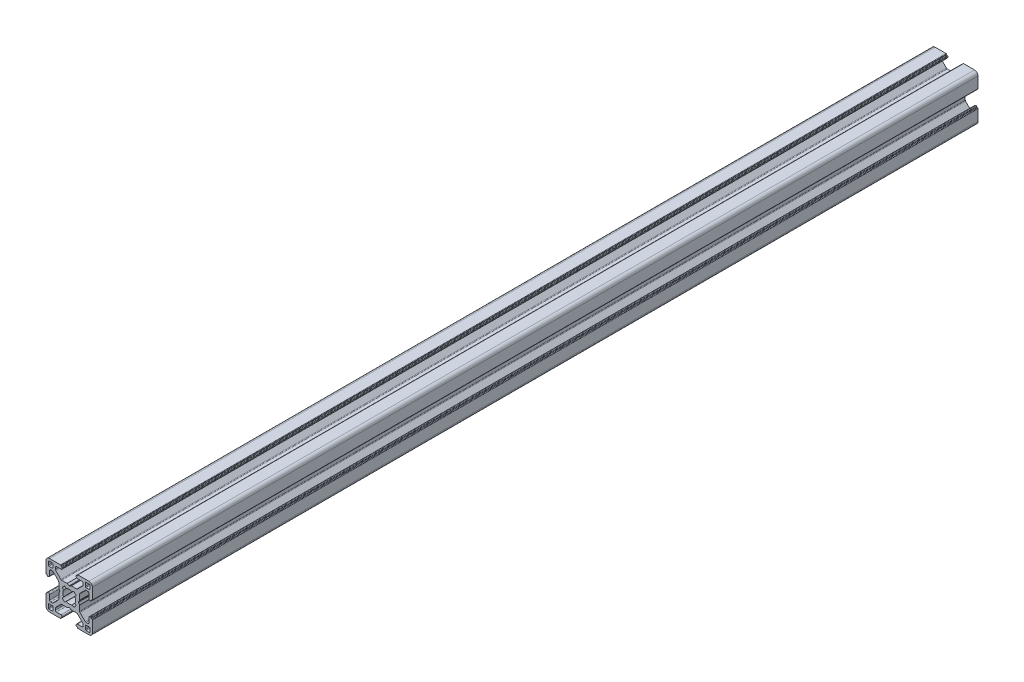
from build123d import *

# Parameters (mm, degrees)
ESTRUSIONE_ESTRUSIONE1_DEPTH = 382


with BuildPart() as part:
    # Schizzo1 → Estrusione-Estrusione1 (new body)
    with BuildSketch(Plane.XY.offset(100)):
        with BuildLine():
            Line((-9.299999732, 3), (-8.999999732, 3))
            ThreePointArc((-8.999999732, 3), (-8.646446341, 3.146446609), (-8.499999732, 3.5))
            Line((-8.499999732, 3.5), (-8.499999732, 5.499999605))
            ThreePointArc((-8.499999732, 5.499999605), (-8.353553123, 5.853552995), (-7.999999732, 5.999999605))
            Line((-7.999999732, 5.999999605), (-7.267766685, 5.999999605))
            ThreePointArc((-7.267766685, 5.999999605), (-7.076424969, 5.961939371), (-6.914213294, 5.853552995))
            Line((-6.914213294, 5.853552995), (-4.646446398, 3.585786099))
            ThreePointArc((-4.646446398, 3.585786099), (-4.538060023, 3.423574425), (-4.499999789, 3.232232708))
            Line((-4.499999789, 3.232232708), (-4.499999789, 0.953589302))
            ThreePointArc((-4.499999789, 0.953589302), (-4.493184953, 0.90182549), (-4.473204867, 0.853589297))
            Line((-4.473204867, 0.853589297), (-4.038119841, 0.099999969))
            ThreePointArc((-4.038119841, 0.099999969), (-4.011324929, 0), (-4.038119841, -0.099999969))
            Line((-4.038119841, -0.099999969), (-4.473204867, -0.853589297))
            ThreePointArc((-4.473204867, -0.853589297), (-4.493184953, -0.90182549), (-4.499999789, -0.953589302))
            Line((-4.499999789, -0.953589302), (-4.499999789, -3.232232708))
            ThreePointArc((-4.499999789, -3.232232708), (-4.538060023, -3.423574425), (-4.646446398, -3.585786099))
            Line((-4.646446398, -3.585786099), (-6.914213294, -5.853552995))
            ThreePointArc((-6.914213294, -5.853552995), (-7.076424969, -5.961939371), (-7.267766685, -5.999999605))
            Line((-7.267766685, -5.999999605), (-7.999999732, -5.999999605))
            ThreePointArc((-7.999999732, -5.999999605), (-8.353553123, -5.853552995), (-8.499999732, -5.499999605))
            Line((-8.499999732, -5.499999605), (-8.499999732, -3.5))
            ThreePointArc((-8.499999732, -3.5), (-8.646446341, -3.146446609), (-8.999999732, -3))
            Line((-8.999999732, -3), (-9.299999732, -3))
            ThreePointArc((-9.299999732, -3), (-9.441421088, -3.058578644), (-9.499999732, -3.2))
            Line((-9.499999732, -3.2), (-9.499999732, -3.349999605))
            ThreePointArc((-9.499999732, -3.349999605), (-9.558578376, -3.491420961), (-9.699999732, -3.549999605))
            Line((-9.699999732, -3.549999605), (-9.8, -3.549999605))
            ThreePointArc((-9.8, -3.549999605), (-9.941421356, -3.608578248), (-10, -3.749999605))
            Line((-10, -3.749999605), (-10, -8.5))
            ThreePointArc((-10, -8.5), (-9.560660172, -9.560660172), (-8.5, -10))
            Line((-8.5, -10), (-3.750000228, -10))
            ThreePointArc((-3.750000228, -10), (-3.608578871, -9.941421356), (-3.550000228, -9.8))
            Line((-3.550000228, -9.8), (-3.550000228, -9.7))
            ThreePointArc((-3.550000228, -9.7), (-3.491421584, -9.558578644), (-3.350000228, -9.5))
            Line((-3.350000228, -9.5), (-3.2, -9.5))
            ThreePointArc((-3.2, -9.5), (-3.058578644, -9.441421356), (-3, -9.3))
            Line((-3, -9.3), (-3, -8.999999673))
            ThreePointArc((-3, -8.999999673), (-3.146446609, -8.646446283), (-3.5, -8.499999673))
            Line((-3.5, -8.499999673), (-5.500000686, -8.499999673))
            ThreePointArc((-5.500000686, -8.499999673), (-5.853554077, -8.353553064), (-6.000000686, -7.999999673))
            Line((-6.000000686, -7.999999673), (-6.000000686, -7.267766626))
            ThreePointArc((-6.000000686, -7.267766626), (-5.961940448, -7.076424899), (-5.853554059, -6.914213219))
            Line((-5.853554059, -6.914213219), (-3.585787212, -4.646446592))
            ThreePointArc((-3.585787212, -4.646446592), (-3.423575544, -4.538060229), (-3.232233839, -4.5))
            Line((-3.232233839, -4.5), (-0.953590312, -4.5))
            ThreePointArc((-0.953590312, -4.5), (-0.901826505, -4.493185166), (-0.853590316, -4.473205083))
            Line((-0.853590316, -4.473205083), (-0.100000045, -4.038119562))
            ThreePointArc((-0.100000045, -4.038119562), (0, -4.011324632), (0.100000045, -4.038119562))
            Line((0.100000045, -4.038119562), (0.853590316, -4.473205083))
            ThreePointArc((0.853590316, -4.473205083), (0.901826505, -4.493185166), (0.953590312, -4.5))
            Line((0.953590312, -4.5), (3.23223292, -4.5))
            ThreePointArc((3.23223292, -4.5), (3.423574636, -4.538060234), (3.58578631, -4.646446609))
            Line((3.58578631, -4.646446609), (5.853554077, -6.914214376))
            ThreePointArc((5.853554077, -6.914214376), (5.961940452, -7.07642605), (6.000000686, -7.267767766))
            Line((6.000000686, -7.267767766), (6.000000686, -7.999999673))
            ThreePointArc((6.000000686, -7.999999673), (5.853554077, -8.353553064), (5.500000686, -8.499999673))
            Line((5.500000686, -8.499999673), (3.5, -8.499999673))
            ThreePointArc((3.5, -8.499999673), (3.146446609, -8.646446283), (3, -8.999999673))
            Line((3, -8.999999673), (3, -9.3))
            ThreePointArc((3, -9.3), (3.058578644, -9.441421356), (3.2, -9.5))
            Line((3.2, -9.5), (3.350000228, -9.5))
            ThreePointArc((3.350000228, -9.5), (3.491421584, -9.558578644), (3.550000228, -9.7))
            Line((3.550000228, -9.7), (3.550000228, -9.8))
            ThreePointArc((3.550000228, -9.8), (3.608578871, -9.941421356), (3.750000228, -10))
            Line((3.750000228, -10), (8.5, -10))
            ThreePointArc((8.5, -10), (9.560660172, -9.560660172), (10, -8.5))
            Line((10, -8.5), (10, -3.749999605))
            ThreePointArc((10, -3.749999605), (9.941421356, -3.608578248), (9.8, -3.549999605))
            Line((9.8, -3.549999605), (9.699999732, -3.549999605))
            ThreePointArc((9.699999732, -3.549999605), (9.558578376, -3.491420961), (9.499999732, -3.349999605))
            Line((9.499999732, -3.349999605), (9.499999732, -3.2))
            ThreePointArc((9.499999732, -3.2), (9.441421088, -3.058578644), (9.299999732, -3))
            Line((9.299999732, -3), (8.999999732, -3))
            ThreePointArc((8.999999732, -3), (8.646446341, -3.146446609), (8.499999732, -3.5))
            Line((8.499999732, -3.5), (8.499999732, -5.499999605))
            ThreePointArc((8.499999732, -5.499999605), (8.353553123, -5.853552995), (7.999999732, -5.999999605))
            Line((7.999999732, -5.999999605), (7.267766789, -5.999999605))
            ThreePointArc((7.267766789, -5.999999605), (7.076425084, -5.961939376), (6.914213416, -5.853553012))
            Line((6.914213416, -5.853553012), (4.646446415, -3.585786233))
            ThreePointArc((4.646446415, -3.585786233), (4.538060027, -3.423574553), (4.499999789, -3.232232825))
            Line((4.499999789, -3.232232825), (4.499999789, -0.953589302))
            ThreePointArc((4.499999789, -0.953589302), (4.493184953, -0.90182549), (4.473204867, -0.853589297))
            Line((4.473204867, -0.853589297), (4.038119841, -0.099999969))
            ThreePointArc((4.038119841, -0.099999969), (4.011324929, 0), (4.038119841, 0.099999969))
            Line((4.038119841, 0.099999969), (4.473204867, 0.853589297))
            ThreePointArc((4.473204867, 0.853589297), (4.493184953, 0.90182549), (4.499999789, 0.953589302))
            Line((4.499999789, 0.953589302), (4.499999789, 3.232232825))
            ThreePointArc((4.499999789, 3.232232825), (4.538060027, 3.423574553), (4.646446415, 3.585786233))
            Line((4.646446415, 3.585786233), (6.914213416, 5.853553012))
            ThreePointArc((6.914213416, 5.853553012), (7.076425084, 5.961939376), (7.267766789, 5.999999605))
            Line((7.267766789, 5.999999605), (7.999999732, 5.999999605))
            ThreePointArc((7.999999732, 5.999999605), (8.353553123, 5.853552995), (8.499999732, 5.499999605))
            Line((8.499999732, 5.499999605), (8.499999732, 3.5))
            ThreePointArc((8.499999732, 3.5), (8.646446341, 3.146446609), (8.999999732, 3))
            Line((8.999999732, 3), (9.299999732, 3))
            ThreePointArc((9.299999732, 3), (9.441421088, 3.058578644), (9.499999732, 3.2))
            Line((9.499999732, 3.2), (9.499999732, 3.349999605))
            ThreePointArc((9.499999732, 3.349999605), (9.558578376, 3.491420961), (9.699999732, 3.549999605))
            Line((9.699999732, 3.549999605), (9.8, 3.549999605))
            ThreePointArc((9.8, 3.549999605), (9.941421356, 3.608578248), (10, 3.749999605))
            Line((10, 3.749999605), (10, 8.5))
            ThreePointArc((10, 8.5), (9.560660172, 9.560660172), (8.5, 10))
            Line((8.5, 10), (3.750000228, 10))
            ThreePointArc((3.750000228, 10), (3.608578871, 9.941421356), (3.550000228, 9.8))
            Line((3.550000228, 9.8), (3.550000228, 9.7))
            ThreePointArc((3.550000228, 9.7), (3.491421584, 9.558578644), (3.350000228, 9.5))
            Line((3.350000228, 9.5), (3.2, 9.5))
            ThreePointArc((3.2, 9.5), (3.058578644, 9.441421356), (3, 9.3))
            Line((3, 9.3), (3, 8.999999673))
            ThreePointArc((3, 8.999999673), (3.146446609, 8.646446283), (3.5, 8.499999673))
            Line((3.5, 8.499999673), (5.500000686, 8.499999673))
            ThreePointArc((5.500000686, 8.499999673), (5.853554077, 8.353553064), (6.000000686, 7.999999673))
            Line((6.000000686, 7.999999673), (6.000000686, 7.267767766))
            ThreePointArc((6.000000686, 7.267767766), (5.961940452, 7.07642605), (5.853554077, 6.914214376))
            Line((5.853554077, 6.914214376), (3.58578631, 4.646446609))
            ThreePointArc((3.58578631, 4.646446609), (3.423574636, 4.538060234), (3.23223292, 4.5))
            Line((3.23223292, 4.5), (0.953590312, 4.5))
            ThreePointArc((0.953590312, 4.5), (0.901826505, 4.493185166), (0.853590316, 4.473205083))
            Line((0.853590316, 4.473205083), (0.100000045, 4.038119562))
            ThreePointArc((0.100000045, 4.038119562), (0, 4.011324632), (-0.100000045, 4.038119562))
            Line((-0.100000045, 4.038119562), (-0.853590316, 4.473205083))
            ThreePointArc((-0.853590316, 4.473205083), (-0.901826505, 4.493185166), (-0.953590312, 4.5))
            Line((-0.953590312, 4.5), (-3.232233839, 4.5))
            ThreePointArc((-3.232233839, 4.5), (-3.423575544, 4.538060229), (-3.585787212, 4.646446592))
            Line((-3.585787212, 4.646446592), (-5.853554059, 6.914213219))
            ThreePointArc((-5.853554059, 6.914213219), (-5.961940448, 7.076424899), (-6.000000686, 7.267766626))
            Line((-6.000000686, 7.267766626), (-6.000000686, 7.999999673))
            ThreePointArc((-6.000000686, 7.999999673), (-5.853554077, 8.353553064), (-5.500000686, 8.499999673))
            Line((-5.500000686, 8.499999673), (-3.5, 8.499999673))
            ThreePointArc((-3.5, 8.499999673), (-3.146446609, 8.646446283), (-3, 8.999999673))
            Line((-3, 8.999999673), (-3, 9.3))
            ThreePointArc((-3, 9.3), (-3.058578644, 9.441421356), (-3.2, 9.5))
            Line((-3.2, 9.5), (-3.350000228, 9.5))
            ThreePointArc((-3.350000228, 9.5), (-3.491421584, 9.558578644), (-3.550000228, 9.7))
            Line((-3.550000228, 9.7), (-3.550000228, 9.8))
            ThreePointArc((-3.550000228, 9.8), (-3.608578871, 9.941421356), (-3.750000228, 10))
            Line((-3.750000228, 10), (-8.5, 10))
            ThreePointArc((-8.5, 10), (-9.560660172, 9.560660172), (-10, 8.5))
            Line((-10, 8.5), (-10, 3.749999605))
            ThreePointArc((-10, 3.749999605), (-9.941421356, 3.608578248), (-9.8, 3.549999605))
            Line((-9.8, 3.549999605), (-9.699999732, 3.549999605))
            ThreePointArc((-9.699999732, 3.549999605), (-9.558578376, 3.491420961), (-9.499999732, 3.349999605))
            Line((-9.499999732, 3.349999605), (-9.499999732, 3.2))
            ThreePointArc((-9.499999732, 3.2), (-9.441421088, 3.058578644), (-9.299999732, 3))
        make_face()
        with BuildLine():
            Line((-1.91389502, 2.989640962), (-1.258185436, 2.445295362))
            ThreePointArc((-1.258185436, 2.445295362), (0, 2.75), (1.258185436, 2.445295362))
            Line((1.258185436, 2.445295362), (1.91389502, 2.989640962))
            ThreePointArc((1.91389502, 2.989640962), (2.511737261, 2.508410485), (2.992174953, 1.909930962))
            Line((2.992174953, 1.909930962), (2.445295423, 1.258185317))
            ThreePointArc((2.445295423, 1.258185317), (2.75, 0), (2.445295423, -1.258185317))
            Line((2.445295423, -1.258185317), (2.992174953, -1.909930962))
            ThreePointArc((2.992174953, -1.909930962), (2.511737261, -2.508410485), (1.91389502, -2.989640962))
            Line((1.91389502, -2.989640962), (1.258185436, -2.445295362))
            ThreePointArc((1.258185436, -2.445295362), (0, -2.75), (-1.258185436, -2.445295362))
            Line((-1.258185436, -2.445295362), (-1.91389502, -2.989640962))
            ThreePointArc((-1.91389502, -2.989640962), (-2.511737261, -2.508410485), (-2.992174953, -1.909930962))
            Line((-2.992174953, -1.909930962), (-2.445295423, -1.258185317))
            ThreePointArc((-2.445295423, -1.258185317), (-2.75, 0), (-2.445295423, 1.258185317))
            Line((-2.445295423, 1.258185317), (-2.992174953, 1.909930962))
            ThreePointArc((-2.992174953, 1.909930962), (-2.511737261, 2.508410485), (-1.91389502, 2.989640962))
        make_face(mode=Mode.SUBTRACT)
        with BuildLine():
            Line((8.699999314, 7.000000686), (7.3, 7.000000686))
            ThreePointArc((7.3, 7.000000686), (7.087867966, 7.087868652), (7, 7.300000686))
            Line((7, 7.300000686), (7, 8.7))
            ThreePointArc((7, 8.7), (7.087867966, 8.912132034), (7.3, 9))
            Line((7.3, 9), (8.699999314, 9))
            ThreePointArc((8.699999314, 9), (8.912131348, 8.912132034), (8.999999314, 8.7))
            Line((8.999999314, 8.7), (8.999999314, 7.300000686))
            ThreePointArc((8.999999314, 7.300000686), (8.912131348, 7.087868652), (8.699999314, 7.000000686))
        make_face(mode=Mode.SUBTRACT)
        with BuildLine():
            Line((-7.300000686, 7.000000686), (-8.7, 7.000000686))
            ThreePointArc((-8.7, 7.000000686), (-8.912132034, 7.087868652), (-9, 7.300000686))
            Line((-9, 7.300000686), (-9, 8.7))
            ThreePointArc((-9, 8.7), (-8.912132034, 8.912132034), (-8.7, 9))
            Line((-8.7, 9), (-7.300000686, 9))
            ThreePointArc((-7.300000686, 9), (-7.087868652, 8.912132034), (-7.000000686, 8.7))
            Line((-7.000000686, 8.7), (-7.000000686, 7.300000686))
            ThreePointArc((-7.000000686, 7.300000686), (-7.087868652, 7.087868652), (-7.300000686, 7.000000686))
        make_face(mode=Mode.SUBTRACT)
        with BuildLine():
            Line((8.699999314, -8.999999314), (7.3, -8.999999314))
            ThreePointArc((7.3, -8.999999314), (7.087867966, -8.912131348), (7, -8.699999314))
            Line((7, -8.699999314), (7, -7.3))
            ThreePointArc((7, -7.3), (7.087867966, -7.087867966), (7.3, -7))
            Line((7.3, -7), (8.699999314, -7))
            ThreePointArc((8.699999314, -7), (8.912131348, -7.087867966), (8.999999314, -7.3))
            Line((8.999999314, -7.3), (8.999999314, -8.699999314))
            ThreePointArc((8.999999314, -8.699999314), (8.912131348, -8.912131348), (8.699999314, -8.999999314))
        make_face(mode=Mode.SUBTRACT)
        with BuildLine():
            Line((-7.300000686, -8.999999314), (-8.7, -8.999999314))
            ThreePointArc((-8.7, -8.999999314), (-8.912132034, -8.912131348), (-9, -8.699999314))
            Line((-9, -8.699999314), (-9, -7.3))
            ThreePointArc((-9, -7.3), (-8.912132034, -7.087867966), (-8.7, -7))
            Line((-8.7, -7), (-7.300000686, -7))
            ThreePointArc((-7.300000686, -7), (-7.087868652, -7.087867966), (-7.000000686, -7.3))
            Line((-7.000000686, -7.3), (-7.000000686, -8.699999314))
            ThreePointArc((-7.000000686, -8.699999314), (-7.087868652, -8.912131348), (-7.300000686, -8.999999314))
        make_face(mode=Mode.SUBTRACT)
    extrude(amount=-ESTRUSIONE_ESTRUSIONE1_DEPTH)


solid = part.part
